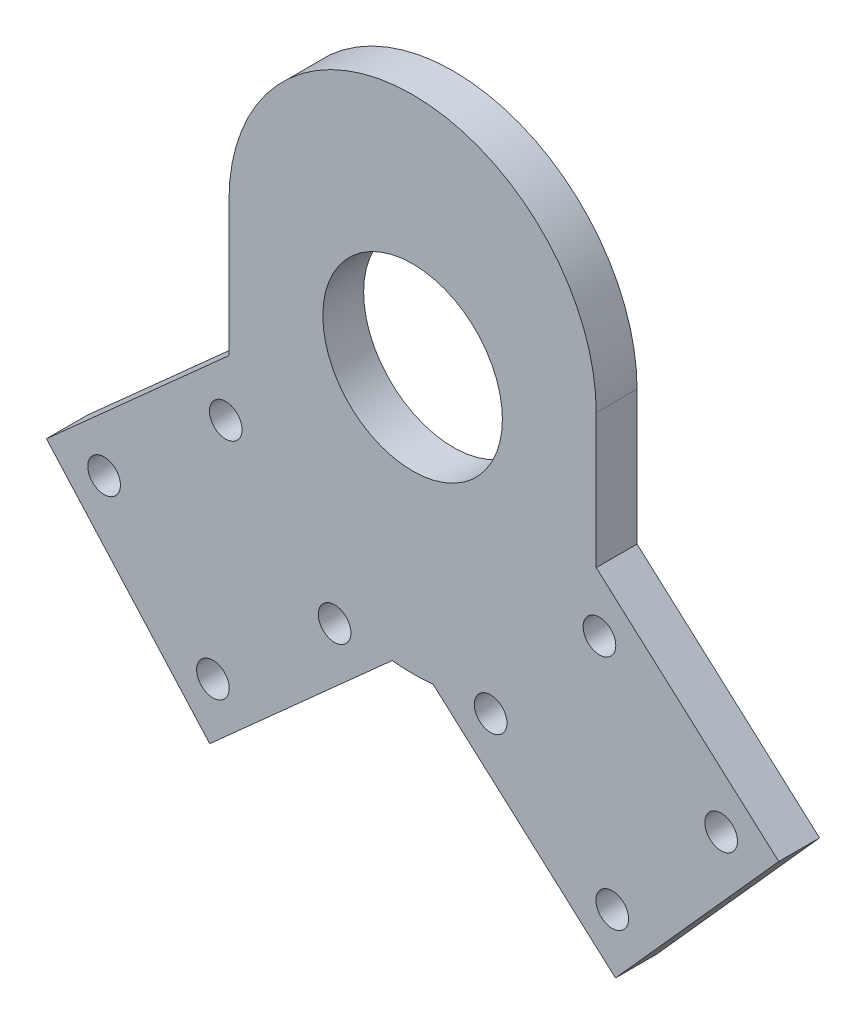
from build123d import *

# Parameters (mm, degrees)
BOSS_EXTRUDE1_DEPTH = 5
SKETCH3_R           = 2
CUT_EXTRUDE1_DEPTH  = 5
SKETCH4_R           = 11
CUT_EXTRUDE2_DEPTH  = 10


with BuildPart() as part:
    # Sketch2 → Boss-Extrude1 (new body)
    with BuildSketch(Plane.XY):
        with BuildLine():
            Line((-15.357210304, 0), (-22.5, 0))
            Line((-22.5, 0), (-2.5, -22.360679775))
            ThreePointArc((-2.5, -22.360679775), (0, -22.5), (2.5, -22.360679775))
            Line((2.5, -22.360679775), (22.5, 0))
            Line((22.5, 0), (15.357210304, 0))
            ThreePointArc((15.357210304, 0), (0, -6.055970942), (-15.357210304, 0))
        make_face()
        with BuildLine():
            ThreePointArc((-2.5, -22.360679775), (-16.770509831, -15), (-22.5, 0))
            Line((-22.5, 0), (-44.860679775, -20))
            Line((-44.860679775, -20), (-24.860679775, -42.360679775))
            Line((-24.860679775, -42.360679775), (-2.5, -22.360679775))
        make_face()
        with BuildLine():
            ThreePointArc((-20.943936523, 8.222014529), (-22.107561735, 4.183983044), (-22.5, 0))
            Line((-22.5, 0), (-15.357210304, 0))
            ThreePointArc((-15.357210304, 0), (-18.61031155, 3.798622619), (-20.943936523, 8.222014529))
        make_face()
        with BuildLine():
            Line((-2.5, -22.360679775), (-22.5, 0))
            ThreePointArc((-22.5, 0), (-16.770509831, -15), (-2.5, -22.360679775))
        make_face()
        with BuildLine():
            Line((-22.5, 16.444029058), (-22.5, 0))
            ThreePointArc((-22.5, 0), (-22.107561735, 4.183983044), (-20.943936523, 8.222014529))
            ThreePointArc((-20.943936523, 8.222014529), (-22.107561735, 12.260046014), (-22.5, 16.444029058))
        make_face()
        with BuildLine():
            ThreePointArc((22.5, 16.444029058), (0, 38.944029058), (-22.5, 16.444029058))
            Line((-22.5, 16.444029058), (-15.357210304, 16.444029058))
            ThreePointArc((-15.357210304, 16.444029058), (0, 22.5), (15.357210304, 16.444029058))
            Line((15.357210304, 16.444029058), (22.5, 16.444029058))
        make_face()
        with BuildLine():
            Line((-15.357210304, 16.444029058), (-22.5, 16.444029058))
            ThreePointArc((-22.5, 16.444029058), (-22.107561735, 12.260046014), (-20.943936523, 8.222014529))
            ThreePointArc((-20.943936523, 8.222014529), (-18.61031155, 12.64540644), (-15.357210304, 16.444029058))
        make_face()
        with BuildLine():
            ThreePointArc((-20.943936523, 8.222014529), (-18.61031155, 3.798622619), (-15.357210304, 0))
            Line((-15.357210304, 0), (15.357210304, 0))
            ThreePointArc((15.357210304, 0), (18.61031155, 3.798622619), (20.943936523, 8.222014529))
            ThreePointArc((20.943936523, 8.222014529), (18.61031155, 12.64540644), (15.357210304, 16.444029058))
            Line((15.357210304, 16.444029058), (-15.357210304, 16.444029058))
            ThreePointArc((-15.357210304, 16.444029058), (-18.61031155, 12.64540644), (-20.943936523, 8.222014529))
        make_face()
        with BuildLine():
            Line((15.357210304, 0), (-15.357210304, 0))
            ThreePointArc((-15.357210304, 0), (0, -6.055970942), (15.357210304, 0))
        make_face()
        with BuildLine():
            ThreePointArc((22.5, 0), (16.770509831, -15), (2.5, -22.360679775))
            Line((2.5, -22.360679775), (24.860679775, -42.360679775))
            Line((24.860679775, -42.360679775), (44.860679775, -20))
            Line((44.860679775, -20), (22.5, 0))
        make_face()
        with BuildLine():
            Line((22.5, 0), (2.5, -22.360679775))
            ThreePointArc((2.5, -22.360679775), (16.770509831, -15), (22.5, 0))
        make_face()
        with BuildLine():
            ThreePointArc((15.357210304, 16.444029058), (0, 22.5), (-15.357210304, 16.444029058))
            Line((-15.357210304, 16.444029058), (15.357210304, 16.444029058))
        make_face()
        with BuildLine():
            ThreePointArc((20.943936523, 8.222014529), (22.107561735, 12.260046014), (22.5, 16.444029058))
            Line((22.5, 16.444029058), (15.357210304, 16.444029058))
            ThreePointArc((15.357210304, 16.444029058), (18.61031155, 12.64540644), (20.943936523, 8.222014529))
        make_face()
        with BuildLine():
            Line((22.5, 0), (22.5, 16.444029058))
            ThreePointArc((22.5, 16.444029058), (22.107561735, 12.260046014), (20.943936523, 8.222014529))
            ThreePointArc((20.943936523, 8.222014529), (22.107561735, 4.183983044), (22.5, 0))
        make_face()
        with BuildLine():
            ThreePointArc((20.943936523, 8.222014529), (18.61031155, 3.798622619), (15.357210304, 0))
            Line((15.357210304, 0), (22.5, 0))
            ThreePointArc((22.5, 0), (22.107561735, 4.183983044), (20.943936523, 8.222014529))
        make_face()
    extrude(amount=BOSS_EXTRUDE1_DEPTH)

    # Sketch3 → Cut-Extrude1 (cut)
    with BuildSketch(Plane(origin=(0, 0, 0), x_dir=(-1, 0, 0), z_dir=(0, 0, -1))):
        with Locations(Location((-37.800566479, -20.393446629, 0), (0, 0, 180))):
            Circle(SKETCH3_R)
        with Locations(Location((-22.893446629, -7.060113296, 0), (0, 0, 180))):
            Circle(SKETCH3_R)
        with Locations(Location((-9.560113296, -21.967233146, 0), (0, 0, 180))):
            Circle(SKETCH3_R)
        with Locations(Location((-24.467233146, -35.300566479, 0), (0, 0, 180))):
            Circle(SKETCH3_R)
        with Locations(Location((24.467233146, -35.300566479, 0), (0, 0, 180))):
            Circle(SKETCH3_R)
        with Locations(Location((37.800566479, -20.393446629, 0), (0, 0, 180))):
            Circle(SKETCH3_R)
        with Locations(Location((9.560113296, -21.967233146, 0), (0, 0, 180))):
            Circle(SKETCH3_R)
        with Locations(Location((22.893446629, -7.060113296, 0), (0, 0, 180))):
            Circle(SKETCH3_R)
    extrude(amount=-CUT_EXTRUDE1_DEPTH, mode=Mode.SUBTRACT)

    # Sketch4 → Cut-Extrude2 (cut)
    with BuildSketch(Plane(origin=(0, 0, 0), x_dir=(-1, 0, 0), z_dir=(0, 0, -1))):
        with Locations((0, 10)):
            Circle(SKETCH4_R)
    extrude(amount=-CUT_EXTRUDE2_DEPTH, mode=Mode.SUBTRACT)


solid = part.part
